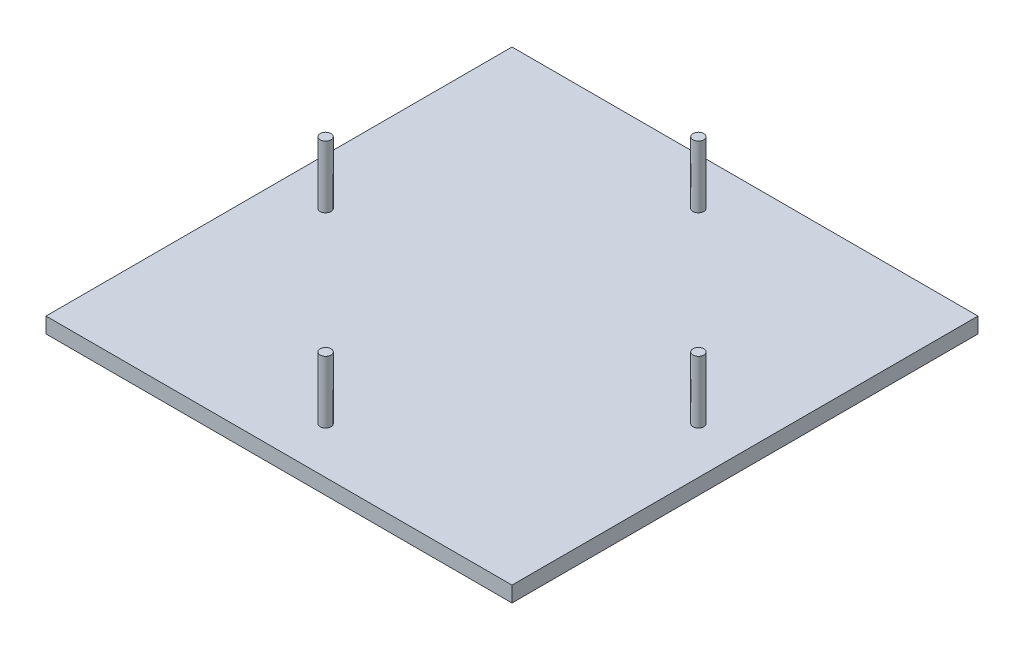
from build123d import *

# Parameters (mm, degrees)
SKETCH1_W           = 150
SKETCH1_H           = 150
BOSS_EXTRUDE1_DEPTH = 5
SKETCH2_R           = 1.75
BOSS_EXTRUDE2_DEPTH = 20
SKETCH3_R           = 15
BOSS_EXTRUDE4_DEPTH = 2
SKETCH5_R           = 6
BOSS_EXTRUDE5_DEPTH = 10
SKETCH6_R           = 15
BOSS_EXTRUDE6_DEPTH = 3


with BuildPart() as part:
    # Sketch1 → Boss-Extrude1 (new body)
    with BuildSketch(Plane(origin=(0, 0, 0), x_dir=(1, 0, 0), z_dir=(0, 1, 0))):
        Rectangle(SKETCH1_W, SKETCH1_H)
    extrude(amount=BOSS_EXTRUDE1_DEPTH)

    # Sketch2 → Boss-Extrude2 (add)
    with BuildSketch(Plane(origin=(0, 5, 0), x_dir=(1, 0, 0), z_dir=(0, 1, 0))):
        with Locations((-60, 0)):
            Circle(SKETCH2_R)
        with Locations((0, 60)):
            Circle(SKETCH2_R)
        with Locations((60, 0)):
            Circle(SKETCH2_R)
        with Locations((0, -60)):
            Circle(SKETCH2_R)
    extrude(amount=BOSS_EXTRUDE2_DEPTH)

    # Sketch3 → Boss-Extrude4 (add)
    with BuildSketch(Plane.XZ):
        Circle(SKETCH3_R)
    extrude(amount=BOSS_EXTRUDE4_DEPTH)

    # Sketch5 → Boss-Extrude5 (add)
    with BuildSketch(Plane.XZ.offset(2)):
        Circle(SKETCH5_R)
    extrude(amount=BOSS_EXTRUDE5_DEPTH)

    # Sketch6 → Boss-Extrude6 (add)
    with BuildSketch(Plane.XZ.offset(12)):
        Circle(SKETCH6_R)
    extrude(amount=BOSS_EXTRUDE6_DEPTH)


solid = part.part
